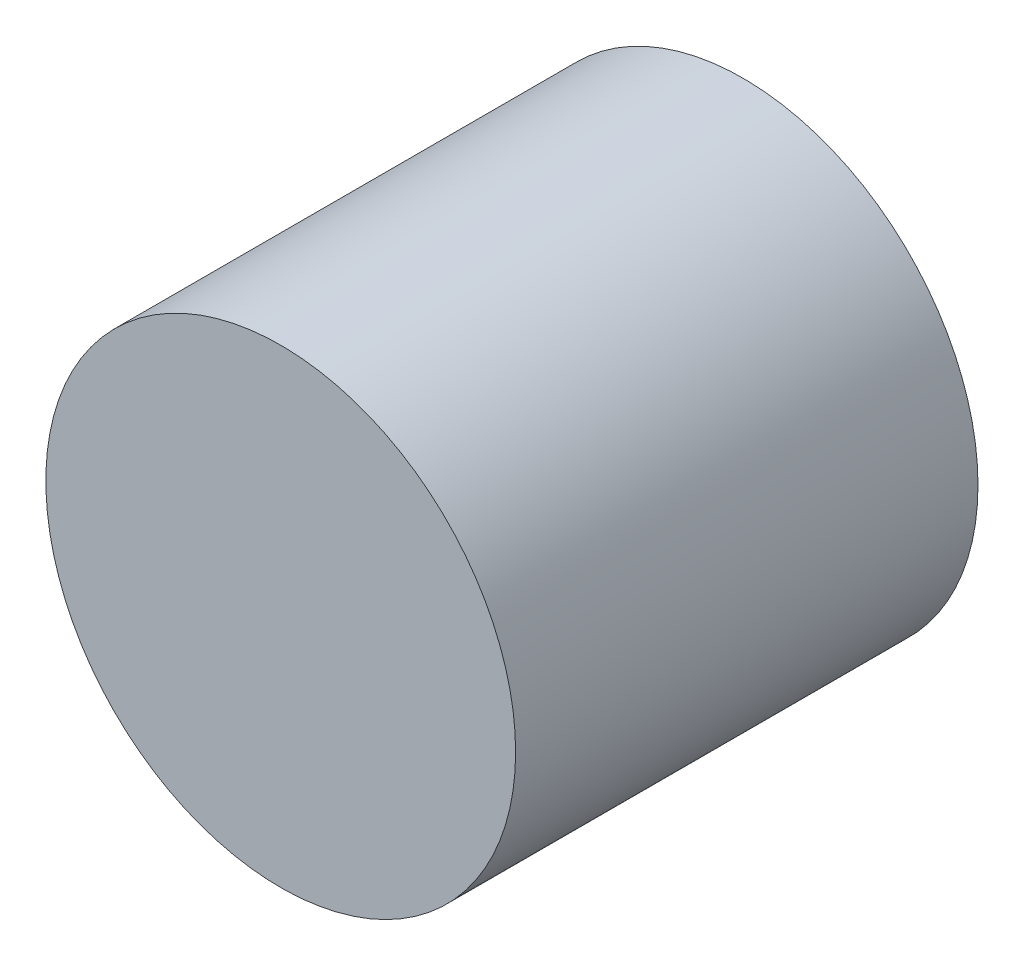
from build123d import *

# Parameters (mm, degrees)
CROQUIS1_R              = 25.4
SALIENTE_EXTRUIR1_DEPTH = 50


with BuildPart() as part:
    # Croquis1 → Saliente-Extruir1 (new body)
    with BuildSketch(Plane.XY):
        Circle(CROQUIS1_R)
    extrude(amount=SALIENTE_EXTRUIR1_DEPTH)


solid = part.part
